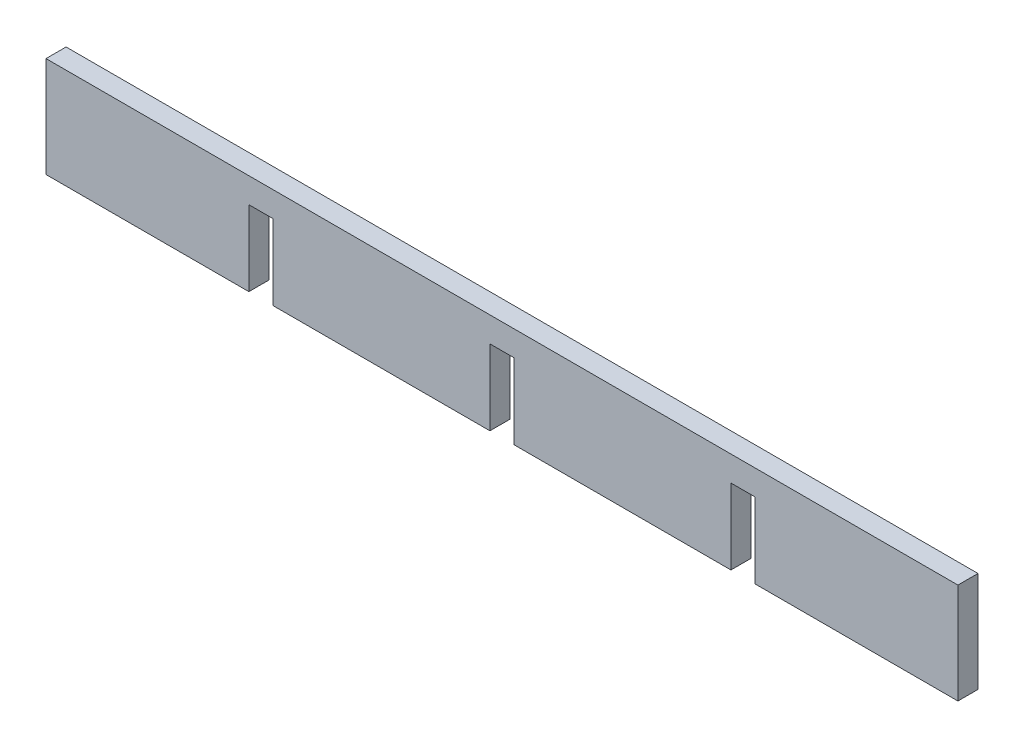
from build123d import *

# Parameters (mm, degrees)
BOSS_EXTRUDE1_DEPTH = 6.35


with BuildPart() as part:
    # Sketch1 → Boss-Extrude1 (new body)
    with BuildSketch(Plane.XY):
        Polygon((-216.535, 0), (-147.955, 0), (-147.955, 23.8125), (-140.335, 23.8125), (-140.335, 0), (-71.755, 0), (-71.755, 23.8125), (-64.135, 23.8125), (-64.135, 0), (0, 0), (0, 31.75), (-288.29, 31.75), (-288.29, 0), (-224.155, 0), (-224.155, 23.8125), (-216.535, 23.8125), align=None)
    extrude(amount=BOSS_EXTRUDE1_DEPTH)


solid = part.part
